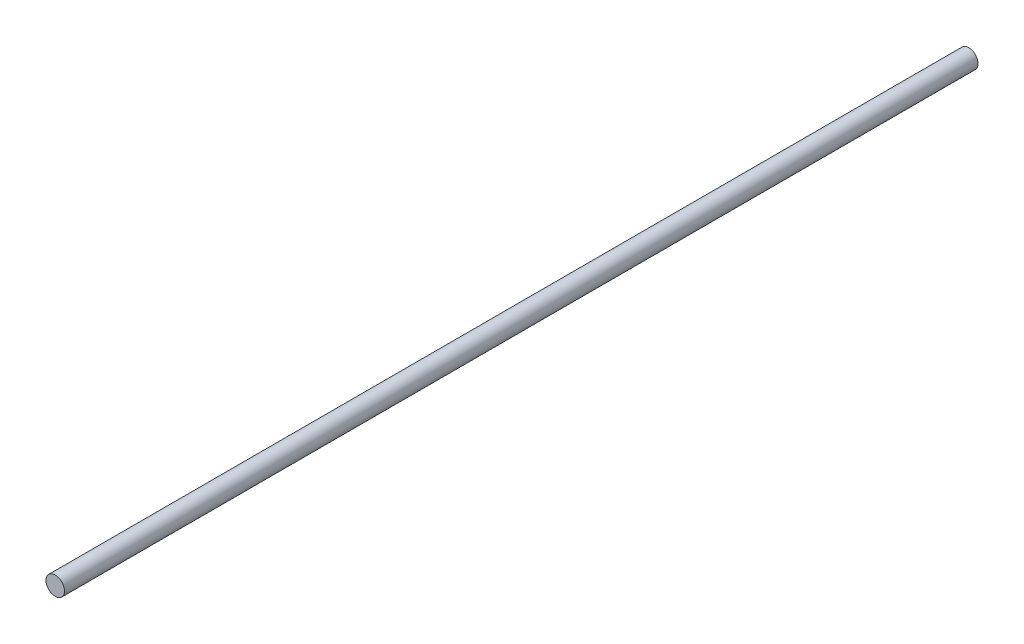
from build123d import *

# Parameters (mm, degrees)
CROQUIS1_R              = 4
SALIENTE_EXTRUIR1_DEPTH = 394


with BuildPart() as part:
    # Croquis1 → Saliente-Extruir1 (new body)
    with BuildSketch(Plane.XY):
        Circle(CROQUIS1_R)
    extrude(amount=SALIENTE_EXTRUIR1_DEPTH)


solid = part.part
